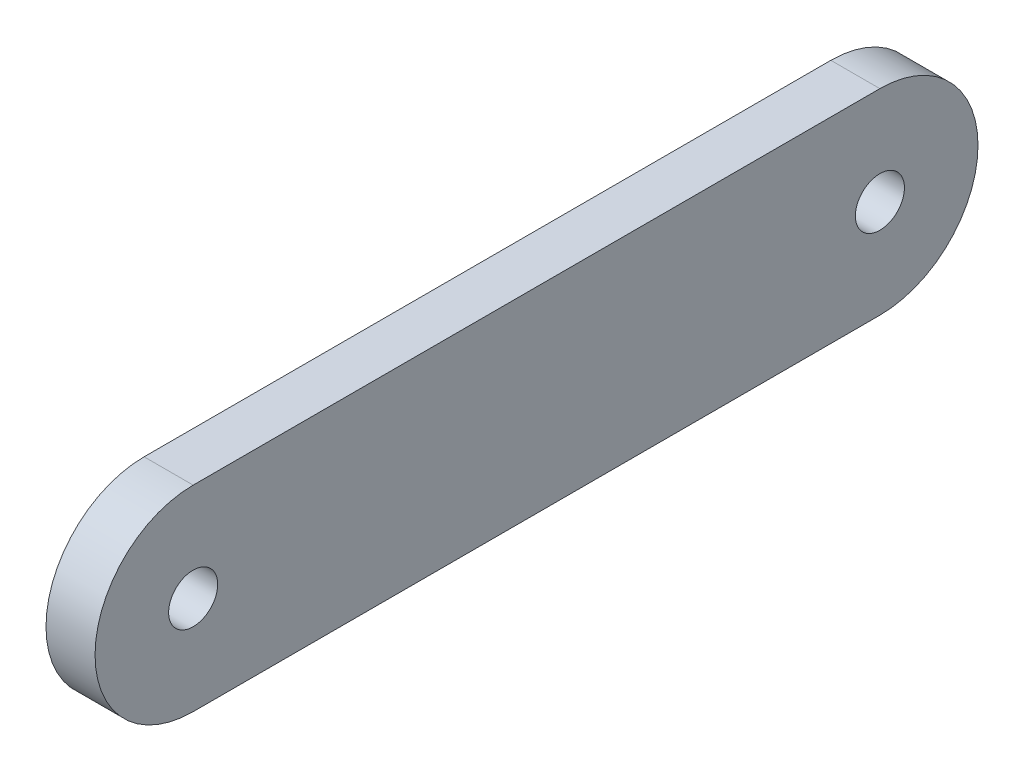
from build123d import *

# Parameters (mm, degrees)
SKETCH1_R           = 2.5
BOSS_EXTRUDE1_DEPTH = 5


with BuildPart() as part:
    # Sketch1 → Boss-Extrude1 (new body)
    with BuildSketch(Plane(origin=(0, 0, 0), x_dir=(0, 0, -1), z_dir=(1, 0, 0))):
        with BuildLine():
            Line((0, 10), (70, 10))
            ThreePointArc((70, 10), (80, 0), (70, -10))
            Line((70, -10), (0, -10))
            ThreePointArc((0, -10), (-10, 0), (0, 10))
        make_face()
        Circle(SKETCH1_R, mode=Mode.SUBTRACT)
        with Locations((70, 0)):
            Circle(SKETCH1_R, mode=Mode.SUBTRACT)
    extrude(amount=BOSS_EXTRUDE1_DEPTH)


solid = part.part
